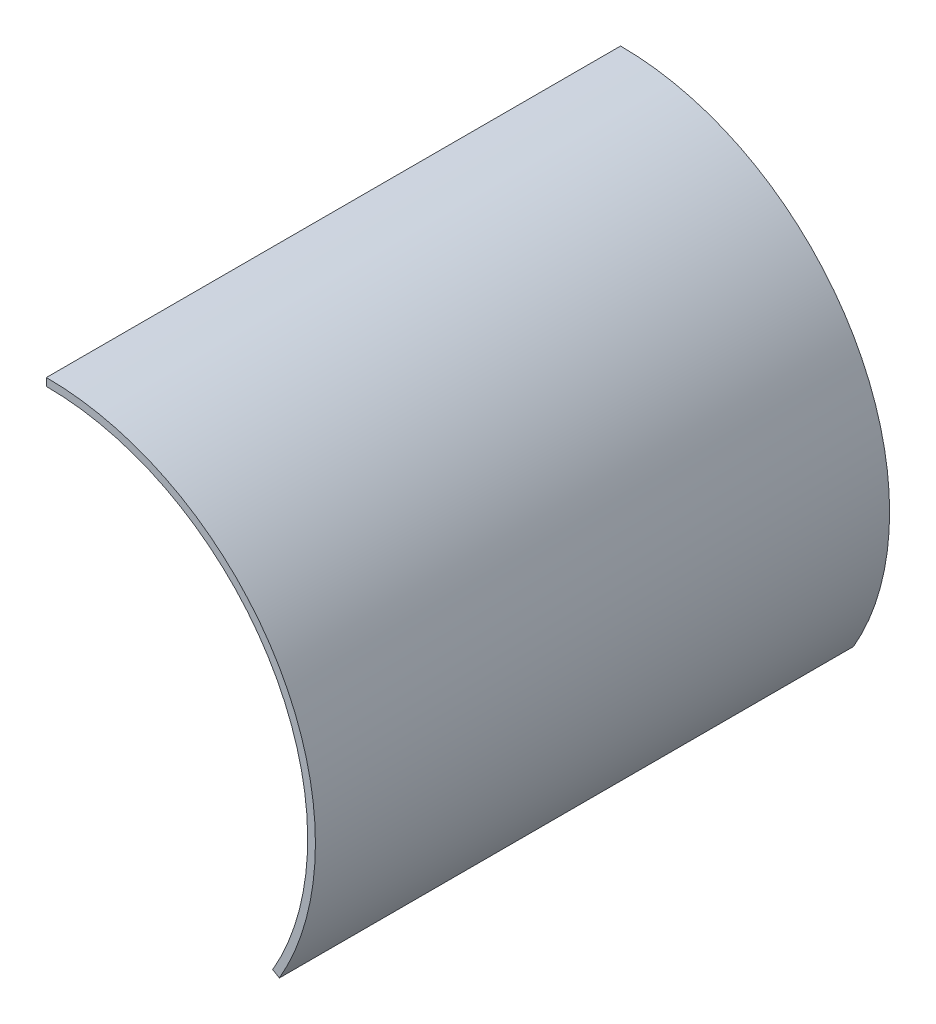
from build123d import *

# Parameters (mm, degrees)
SKETCH_1_W      = 89
SKETCH_1_H      = 1.2
REVOLVE_1_ANGLE = 120


with BuildPart() as part:
    # Эскиз1 → Повернуть1 (revolve)
    with BuildSketch(Plane(origin=(0, 0, 0), x_dir=(0, 0, -1), z_dir=(1, 0, 0))):
        with Locations((44.5, 41.1)):
            Rectangle(SKETCH_1_W, SKETCH_1_H)
    revolve(axis=Axis((0, 0, 0), (0, 0, -1)), revolution_arc=REVOLVE_1_ANGLE)


solid = part.part
